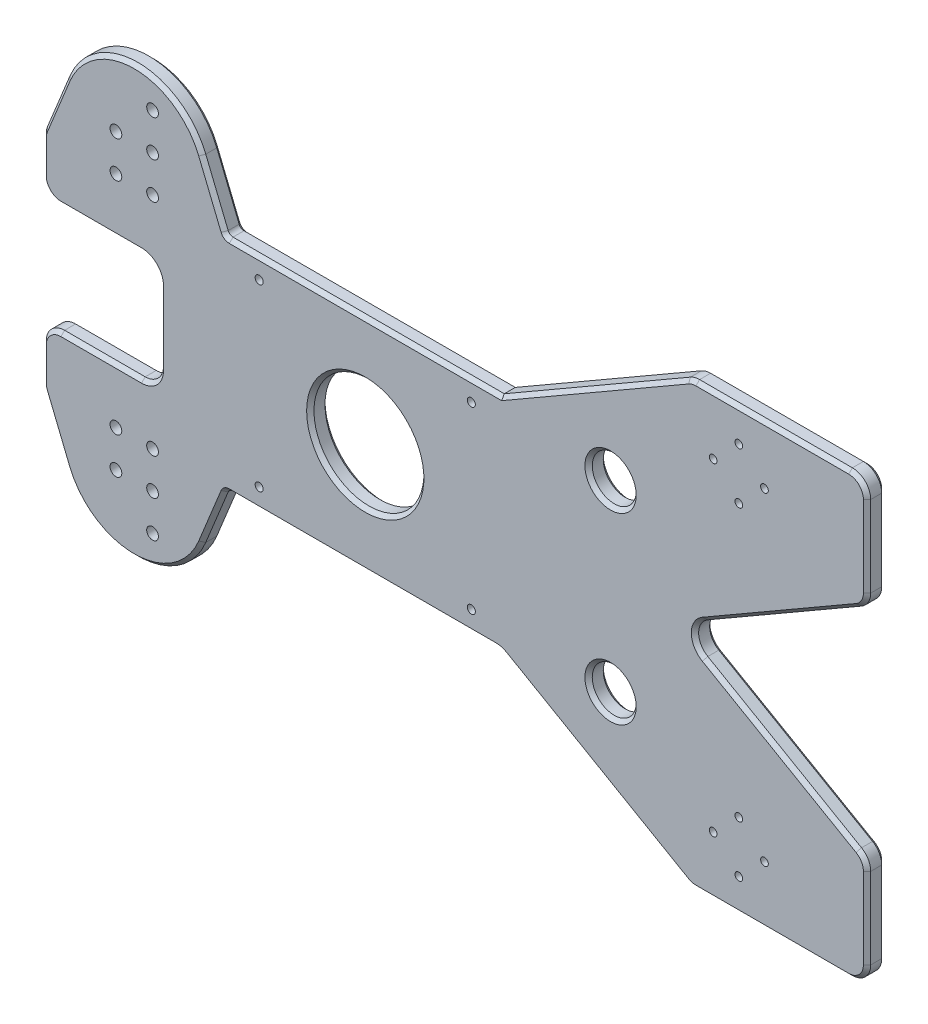
from build123d import *

# Parameters (mm, degrees)
EXTRUDE_1_DEPTH     = 2.5
SKETCH_2_R          = 1.6
CUT_EXTRUDE_1_DEPTH = 139.744369255
SKETCH_3_R          = 1.05
CUT_EXTRUDE_2_DEPTH = 139.744369255
SKETCH_4_R          = 1.1
SKETCH_4_R_2        = 15
SKETCH_4_R_3        = 6
CUT_EXTRUDE_3_DEPTH = 139.744369255
CHAMFER_1_SIZE      = 1
CHAMFER_2_SIZE      = 1


with BuildPart() as part:
    # 草图1 → 凸台-拉伸1 (new, symmetric)
    with BuildSketch(Plane.XY):
        with BuildLine():
            Line((-125, 29), (-125, 20))
            ThreePointArc((-125, 20), (-123.535533906, 16.464466094), (-120, 15))
            Line((-120, 15), (-98, 15))
            ThreePointArc((-98, 15), (-94.464466094, 13.535533906), (-93, 10))
            Line((-93, 10), (-93, -10))
            ThreePointArc((-93, -10), (-94.464466094, -13.535533906), (-98, -15))
            Line((-98, -15), (-120, -15))
            ThreePointArc((-120, -15), (-123.535533906, -16.464466094), (-125, -20))
            Line((-125, -20), (-125, -29))
            ThreePointArc((-125, -29), (-124.906679931, -29.9615051), (-124.630203177, -30.88711911))
            Line((-124.630203177, -30.88711911), (-118.51669464, -45.88711911))
            ThreePointArc((-118.51669464, -45.88711911), (-99.99588193, -58.338642669), (-81.475069221, -45.88711911))
            Line((-81.475069221, -45.88711911), (-75.361560684, -30.88711911))
            ThreePointArc((-75.361560684, -30.88711911), (-74.837036555, -30.24239728), (-74.04203004, -30))
            Line((-74.04203004, -30), (-1.339745962, -30))
            ThreePointArc((-1.339745962, -30), (-0.045650737, -30.170370869), (1.160254038, -30.669872981))
            Line((1.160254038, -30.669872981), (50.801270189, -59.330127019))
            ThreePointArc((50.801270189, -59.330127019), (52.007174964, -59.829629131), (53.301270189, -60))
            Line((53.301270189, -60), (95, -60))
            ThreePointArc((95, -60), (98.535533906, -58.535533906), (100, -55))
            Line((100, -55), (100, -32.886751346))
            ThreePointArc((100, -32.886751346), (99.330127019, -30.386751346), (97.5, -28.556624327))
            Line((97.5, -28.556624327), (55.538475773, -4.330127019))
            ThreePointArc((55.538475773, -4.330127019), (53.038475773, 0), (55.538475773, 4.330127019))
            Line((55.538475773, 4.330127019), (97.5, 28.556624327))
            ThreePointArc((97.5, 28.556624327), (99.330127019, 30.386751346), (100, 32.886751346))
            Line((100, 32.886751346), (100, 55))
            ThreePointArc((100, 55), (98.535533906, 58.535533906), (95, 60))
            Line((95, 60), (53.301270189, 60))
            ThreePointArc((53.301270189, 60), (52.007174964, 59.829629131), (50.801270189, 59.330127019))
            Line((50.801270189, 59.330127019), (0, 30))
            Line((0, 30), (-74.04203004, 30))
            ThreePointArc((-74.04203004, 30), (-74.837036555, 30.24239728), (-75.361560684, 30.88711911))
            Line((-75.361560684, 30.88711911), (-81.475069221, 45.88711911))
            ThreePointArc((-81.475069221, 45.88711911), (-99.99588193, 58.338642669), (-118.51669464, 45.88711911))
            Line((-118.51669464, 45.88711911), (-124.630203177, 30.88711911))
            ThreePointArc((-124.630203177, 30.88711911), (-124.906679931, 29.9615051), (-125, 29))
        make_face()
    extrude(amount=EXTRUDE_1_DEPTH, both=True)

    # 草图2 → 切除-拉伸1 (cut, through all)
    with BuildSketch(Plane.XY.offset(2.5)):
        with Locations((-104.99588193, 40)):
            Circle(SKETCH_2_R)
        with Locations((-94.99588193, 40)):
            Circle(SKETCH_2_R)
        with Locations(Location((-94.99588193, -40, 0), (0, 0, 180))):
            Circle(SKETCH_2_R)
        with Locations(Location((-104.99588193, -40, 0), (0, 0, 180))):
            Circle(SKETCH_2_R)
        with Locations((-104.99588193, 30)):
            Circle(SKETCH_2_R)
        with Locations((-94.99588193, 30)):
            Circle(SKETCH_2_R)
        with Locations(Location((-94.99588193, -30, 0), (0, 0, 180))):
            Circle(SKETCH_2_R)
        with Locations(Location((-104.99588193, -30, 0), (0, 0, 180))):
            Circle(SKETCH_2_R)
        with Locations((-94.99588193, 50)):
            Circle(SKETCH_2_R)
        with Locations(Location((-94.99588193, -50, 0), (0, 0, 180))):
            Circle(SKETCH_2_R)
    extrude(amount=-CUT_EXTRUDE_1_DEPTH, mode=Mode.SUBTRACT)

    # 草图3 → 切除-拉伸2 (cut, through all)
    with BuildSketch(Plane.XY.offset(2.5)):
        with Locations((65, 51.1)):
            Circle(SKETCH_3_R)
        with Locations((72, 44.1)):
            Circle(SKETCH_3_R)
        with Locations((58, 44.1)):
            Circle(SKETCH_3_R)
        with Locations((65, 37.1)):
            Circle(SKETCH_3_R)
        with Locations(Location((65, -37.1, 0), (0, 0, 180))):
            Circle(SKETCH_3_R)
        with Locations(Location((58, -44.1, 0), (0, 0, 180))):
            Circle(SKETCH_3_R)
        with Locations(Location((72, -44.1, 0), (0, 0, 180))):
            Circle(SKETCH_3_R)
        with Locations(Location((65, -51.1, 0), (0, 0, 180))):
            Circle(SKETCH_3_R)
    extrude(amount=-CUT_EXTRUDE_2_DEPTH, mode=Mode.SUBTRACT)

    # 草图4 → 切除-拉伸3 (cut, through all)
    with BuildSketch(Plane.XY.offset(2.5)):
        with Locations((-65.894, 24.476)):
            Circle(SKETCH_4_R)
        with Locations((-65.894, -24.476)):
            Circle(SKETCH_4_R)
        with Locations((-8, -24.476)):
            Circle(SKETCH_4_R)
        with Locations((-8, 24.476)):
            Circle(SKETCH_4_R)
        with Locations((-36.947, 0)):
            Circle(SKETCH_4_R_2)
        with Locations((30, 25)):
            Circle(SKETCH_4_R_3)
        with Locations((30, -25)):
            Circle(SKETCH_4_R_3)
    extrude(amount=-CUT_EXTRUDE_3_DEPTH, mode=Mode.SUBTRACT)

    # 倒角1
    chamfer_1_edges = [part.edges().sort_by_distance(p)[0] for p in [
        (53.038475773, 0, 2.5),
        (76.519237886, 16.443375673, 2.5),
        (99.330127019, 30.386751346, 2.5),
        (100, 43.943375673, 2.5),
        (98.535533906, 58.535533906, 2.5),
        (74.150635095, 60, 2.5),
        (52.007174964, 59.829629131, 2.5),
        (25.400635095, 44.665063509, 2.5),
        (-123.535533906, 16.464466094, 2.5),
        (-37.02101502, 30, 2.5),
        (-74.837036555, 30.24239728, 2.5),
        (-78.418314952, 38.38711911, 2.5),
        (-99.99588193, 58.338642669, 2.5),
        (-121.573448909, 38.38711911, 2.5),
        (-109, 15, 2.5),
        (-94.464466094, 13.535533906, 2.5),
        (-93, 0, 2.5),
        (-94.464466094, -13.535533906, 2.5),
        (-109, -15, 2.5),
        (-121.573448909, 38.38711911, -2.5),
        (-99.99588193, 58.338642669, -2.5),
        (-78.418314952, 38.38711911, -2.5),
        (-74.837036555, 30.24239728, -2.5),
        (-37.02101502, 30, -2.5),
        (25.400635095, 44.665063509, -2.5),
        (-123.535533906, -16.464466094, 2.5),
        (52.007174964, 59.829629131, -2.5),
        (74.150635095, 60, -2.5),
        (98.535533906, 58.535533906, -2.5),
        (100, 43.943375673, -2.5),
        (99.330127019, 30.386751346, -2.5),
        (76.519237886, 16.443375673, -2.5),
        (53.038475773, 0, -2.5),
        (76.519237886, -16.443375673, -2.5),
        (99.330127019, -30.386751346, -2.5),
        (100, -43.943375673, -2.5),
        (-125, -24.5, 2.5),
        (98.535533906, -58.535533906, -2.5),
        (74.150635095, -60, -2.5),
        (52.007174964, -59.829629131, -2.5),
        (25.980762114, -45, -2.5),
        (-0.045650737, -30.170370869, -2.5),
        (-37.690888001, -30, -2.5),
        (-74.837036555, -30.24239728, -2.5),
        (-78.418314952, -38.38711911, -2.5),
        (-99.99588193, -58.338642669, -2.5),
        (-121.573448909, -38.38711911, -2.5),
        (-124.906679931, -29.9615051, 2.5),
        (-124.906679931, -29.9615051, -2.5),
        (-125, -24.5, -2.5),
        (-123.535533906, -16.464466094, -2.5),
        (-109, -15, -2.5),
        (-94.464466094, -13.535533906, -2.5),
        (-93, 0, -2.5),
        (-94.464466094, 13.535533906, -2.5),
        (-109, 15, -2.5),
        (-123.535533906, 16.464466094, -2.5),
        (-125, 24.5, -2.5),
        (-121.573448909, -38.38711911, 2.5),
        (-124.906679931, 29.9615051, -2.5),
        (-124.906679931, 29.9615051, 2.5),
        (-99.99588193, -58.338642669, 2.5),
        (-78.418314952, -38.38711911, 2.5),
        (-74.837036555, -30.24239728, 2.5),
        (-37.690888001, -30, 2.5),
        (-0.045650737, -30.170370869, 2.5),
        (25.980762114, -45, 2.5),
        (52.007174964, -59.829629131, 2.5),
        (74.150635095, -60, 2.5),
        (98.535533906, -58.535533906, 2.5),
        (100, -43.943375673, 2.5),
        (-125, 24.5, 2.5),
        (99.330127019, -30.386751346, 2.5),
        (76.519237886, -16.443375673, 2.5),
    ]]
    chamfer(chamfer_1_edges, length=CHAMFER_1_SIZE)

    # 倒角2
    chamfer_2_edges = [part.edges().sort_by_distance(p)[0] for p in [
        (24, -25, -2.5),
        (24, -25, 2.5),
        (24, 25, -2.5),
        (24, 25, 2.5),
        (-51.947, 0, -2.5),
        (-51.947, 0, 2.5),
    ]]
    chamfer(chamfer_2_edges, length=CHAMFER_2_SIZE)


solid = part.part
